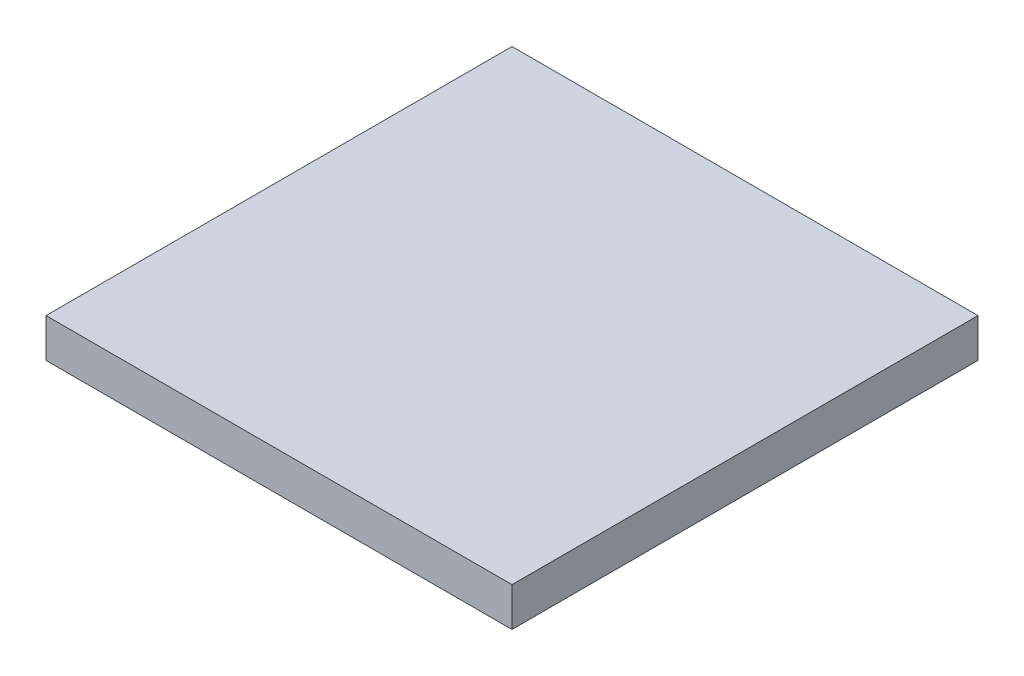
from build123d import *

# Parameters (mm, degrees)
CROQUIS1_W              = 304.8
CROQUIS1_H              = 304.8
SALIENTE_EXTRUIR1_DEPTH = 25.4


with BuildPart() as part:
    # Croquis1 → Saliente-Extruir1 (new body)
    with BuildSketch(Plane(origin=(0, 0, 0), x_dir=(1, 0, 0), z_dir=(0, 1, 0))):
        Rectangle(CROQUIS1_W, CROQUIS1_H)
    extrude(amount=SALIENTE_EXTRUIR1_DEPTH)


solid = part.part
